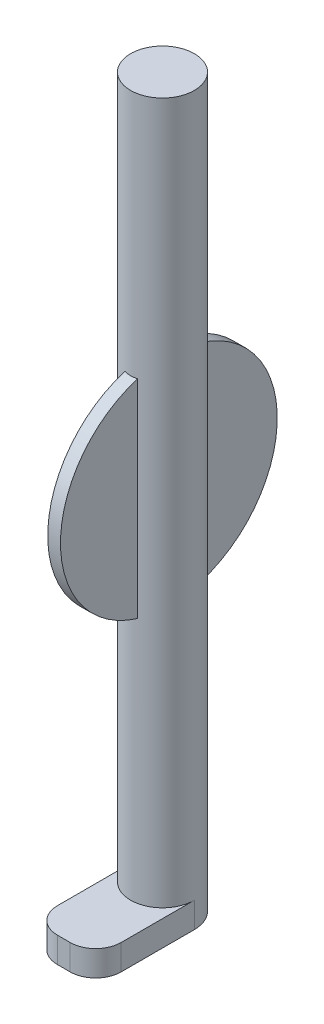
from build123d import *

# Parameters (mm, degrees)
SKETCH1_R                = 2.5
BOSS_EXTRUDE1_DEPTH      = 55
BOSS_EXTRUDE2_DEPTH      = 0.5
BOSS_EXTRUDE2_DEPTH_BACK = 0.5
SKETCH2_R                = 8.5
BOSS_EXTRUDE3_START      = 2
BOSS_EXTRUDE3_DEPTH      = 2
FILLET1_R                = 2


with BuildPart() as part:
    # Sketch1 → Boss-Extrude1 (new body)
    with BuildSketch(Plane(origin=(0, 0, 0), x_dir=(1, 0, 0), z_dir=(0, 1, 0))):
        Circle(SKETCH1_R)
    extrude(amount=BOSS_EXTRUDE1_DEPTH)

    # Sketch2 → Boss-Extrude2 (add, two sides: drawn at the far end of the back side and taken through both)
    with BuildSketch(Plane(origin=(0, 0, 0), x_dir=(0, 0, -1), z_dir=(1, 0, 0)).offset(-BOSS_EXTRUDE2_DEPTH_BACK)):
        with Locations((0, 27.5)):
            Circle(SKETCH2_R)
    extrude(amount=BOSS_EXTRUDE2_DEPTH + BOSS_EXTRUDE2_DEPTH_BACK)

    # Sketch3 → Boss-Extrude3 (add)
    with BuildSketch(Plane.XZ.offset(BOSS_EXTRUDE3_START)):
        with BuildLine():
            Line((-2.5, 0), (-2.5, 7.742565285))
            Line((-2.5, 7.742565285), (2.5, 7.742565285))
            Line((2.5, 7.742565285), (2.5, 0))
            ThreePointArc((2.5, 0), (0, -2.5), (-2.5, 0))
        make_face()
    extrude(amount=-BOSS_EXTRUDE3_DEPTH)

    # Fillet1
    fillet1_edges = [part.edges().sort_by_distance(p)[0] for p in [
        (-2.5, -1, 7.742565285),
        (2.5, -1, 7.742565285),
    ]]
    fillet(fillet1_edges, radius=FILLET1_R)


solid = part.part
